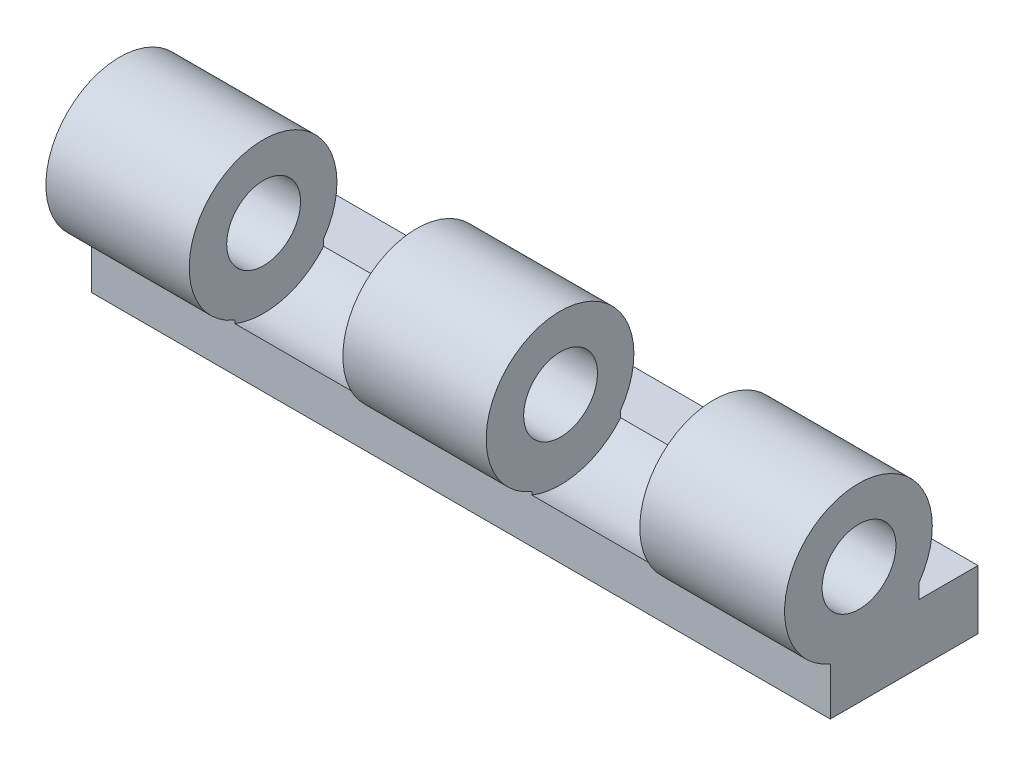
from build123d import *

# Parameters (mm, degrees)
SKETCH1_W           = 250
SKETCH1_H           = 25
BOSS_EXTRUDE1_DEPTH = 50
SKETCH2_W           = 220
SKETCH2_H           = 10
CUT_EXTRUDE1_DEPTH  = 35
SKETCH3_R           = 25
BOSS_EXTRUDE2_DEPTH = 49
LPATTERN1_COUNT     = 3
LPATTERN1_PITCH     = 100.5
SKETCH7_R           = 12.5
CUT_EXTRUDE2_DEPTH  = 250
SKETCH8_W           = 250
SKETCH8_H           = 19.943004224
CUT_EXTRUDE3_DEPTH  = 5
SKETCH10_R          = 26.5
CUT_EXTRUDE4_DEPTH  = 52
SKETCH15_R          = 26.5
CUT_EXTRUDE5_DEPTH  = 52


with BuildPart() as part:
    # Sketch1 → Boss-Extrude1 (new body)
    with BuildSketch(Plane.XY):
        with Locations((110, 12.5)):
            Rectangle(SKETCH1_W, SKETCH1_H)
    extrude(amount=BOSS_EXTRUDE1_DEPTH)

    # Sketch2 → Cut-Extrude1 (cut)
    with BuildSketch(Plane(origin=(0, 0, 0), x_dir=(-1, 0, 0), z_dir=(0, 0, -1))):
        with Locations((-110, 5)):
            Rectangle(SKETCH2_W, SKETCH2_H)
    extrude(amount=-CUT_EXTRUDE1_DEPTH, mode=Mode.SUBTRACT)

    # Sketch3 → Boss-Extrude2 (add)
    with BuildSketch(Plane.ZY.offset(15)):
        with Locations((40.462008594, 39.281822702)):
            Circle(SKETCH3_R)
    boss_extrude2 = extrude(amount=-BOSS_EXTRUDE2_DEPTH)

    # LPattern1: Boss-Extrude2 ×3
    with Locations(*[(i * LPATTERN1_PITCH, 0, 0) for i in range(1, LPATTERN1_COUNT)]):
        add(boss_extrude2)

    # Sketch7 → Cut-Extrude2 (cut)
    with BuildSketch(Plane.ZY.offset(15)):
        with Locations((40.272500431, 39.79236851)):
            Circle(SKETCH7_R)
    extrude(amount=-CUT_EXTRUDE2_DEPTH, mode=Mode.SUBTRACT)

    # Sketch8 → Cut-Extrude3 (cut)
    with BuildSketch(Plane(origin=(0, 25, 0), x_dir=(1, 0, 0), z_dir=(0, 1, 0))):
        with Locations((110, -9.971502112)):
            Rectangle(SKETCH8_W, SKETCH8_H)
    extrude(amount=-CUT_EXTRUDE3_DEPTH, mode=Mode.SUBTRACT)

    # Sketch10 → Cut-Extrude4 (cut)
    with BuildSketch(Plane.ZY.offset(-85.5)):
        with Locations((40.272500431, 39.79236851)):
            Circle(SKETCH10_R)
    extrude(amount=CUT_EXTRUDE4_DEPTH, mode=Mode.SUBTRACT)

    # Sketch15 → Cut-Extrude5 (cut)
    with BuildSketch(Plane.ZY.offset(-186)):
        with Locations((40.272500431, 39.79236851)):
            Circle(SKETCH15_R)
    extrude(amount=CUT_EXTRUDE5_DEPTH, mode=Mode.SUBTRACT)


solid = part.part
